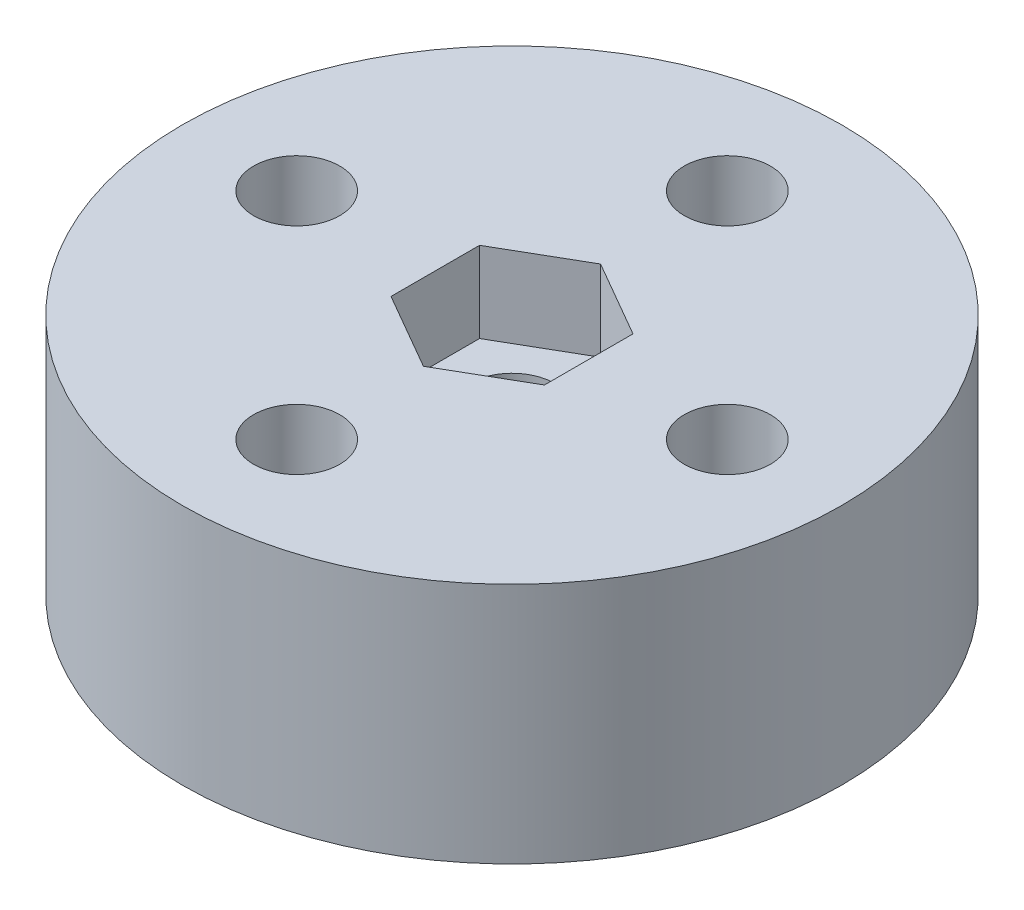
from build123d import *

# Parameters (mm, degrees)
SKETCH_1_R      = 12.25
SKETCH_1_R_2    = 1.6
EXTRUDE_1_DEPTH = 3
EXTRUDE_START   = 3
SKETCH_1_3_R    = 12.25
SKETCH_1_3_R_2  = 1.6
EXTRUDE_2_DEPTH = 3
SKETCH_1_4_R    = 1.6
EXTRUDE_3_DEPTH = 3
SKETCH_1_5_R    = 12.25
SKETCH_1_5_R_2  = 1.6
EXTRUDE_4_DEPTH = 3


with BuildPart() as part:
    # 草图1 → 凸台-拉伸1 (new body)
    # profile 1 of 2: a face of its own
    with BuildSketch(Plane(origin=(0, 0, 0), x_dir=(1, 0, 0), z_dir=(0, 1, 0))):
        with Locations(Location((0, 0, 0), (0, 0, 270))):
            Circle(SKETCH_1_R)
        with Locations(Location((-8, 0, 0), (0, 0, 270))):
            Circle(SKETCH_1_R_2, mode=Mode.SUBTRACT)
        with Locations(Location((0, -8, 0), (0, 0, 270))):
            Circle(SKETCH_1_R_2, mode=Mode.SUBTRACT)
        with Locations(Location((8, 0, 0), (0, 0, 270))):
            Circle(SKETCH_1_R_2, mode=Mode.SUBTRACT)
        with Locations(Location((0, 8, 0), (0, 0, 270))):
            Circle(SKETCH_1_R_2, mode=Mode.SUBTRACT)
        Polygon((-2.85, -1.645448267), (0, -3.290896534), (2.85, -1.645448267), (2.85, 1.645448267), (0, 3.290896534), (-2.85, 1.645448267), align=None, mode=Mode.SUBTRACT)
    # profile 2 of 2: a face of its own
    with BuildSketch(Plane(origin=(0, 0, 0), x_dir=(1, 0, 0), z_dir=(0, 1, 0))):
        Polygon((-2.85, 1.645448267), (-2.85, -1.645448267), (0, -3.290896534), (2.85, -1.645448267), (2.85, 1.645448267), (0, 3.290896534), align=None)
        with Locations(Location((0, 0, 0), (0, 0, 270))):
            Circle(SKETCH_1_R_2, mode=Mode.SUBTRACT)
    extrude(amount=-EXTRUDE_1_DEPTH)

    # 草图1<3> → 凸台-拉伸2 (add)
    with BuildSketch(Plane(origin=(0, 0, 0), x_dir=(1, 0, 0), z_dir=(0, 1, 0)).offset(EXTRUDE_START)):
        with Locations(Location((0, 0, 0), (0, 0, 270))):
            Circle(SKETCH_1_3_R)
        with Locations(Location((-8, 0, 0), (0, 0, 270))):
            Circle(SKETCH_1_3_R_2, mode=Mode.SUBTRACT)
        with Locations(Location((0, -8, 0), (0, 0, 270))):
            Circle(SKETCH_1_3_R_2, mode=Mode.SUBTRACT)
        with Locations(Location((8, 0, 0), (0, 0, 270))):
            Circle(SKETCH_1_3_R_2, mode=Mode.SUBTRACT)
        with Locations(Location((0, 8, 0), (0, 0, 270))):
            Circle(SKETCH_1_3_R_2, mode=Mode.SUBTRACT)
        Polygon((-2.85, -1.645448267), (0, -3.290896534), (2.85, -1.645448267), (2.85, 1.645448267), (0, 3.290896534), (-2.85, 1.645448267), align=None, mode=Mode.SUBTRACT)
    extrude(amount=-EXTRUDE_2_DEPTH)

    # 草图1<4> → 凸台-拉伸3 (add)
    with BuildSketch(Plane(origin=(0, 0, 0), x_dir=(1, 0, 0), z_dir=(0, 1, 0)).offset(EXTRUDE_START)):
        Polygon((-2.85, 1.645448267), (-2.85, -1.645448267), (0, -3.290896534), (2.85, -1.645448267), (2.85, 1.645448267), (0, 3.290896534), align=None)
        with Locations(Location((0, 0, 0), (0, 0, 270))):
            Circle(SKETCH_1_4_R, mode=Mode.SUBTRACT)
    extrude(amount=-EXTRUDE_3_DEPTH)

    # 草图1<5> → 凸台-拉伸4 (add)
    with BuildSketch(Plane(origin=(0, 0, 0), x_dir=(1, 0, 0), z_dir=(0, 1, 0)).offset(EXTRUDE_START)):
        with Locations(Location((0, 0, 0), (0, 0, 270))):
            Circle(SKETCH_1_5_R)
        with Locations(Location((-8, 0, 0), (0, 0, 270))):
            Circle(SKETCH_1_5_R_2, mode=Mode.SUBTRACT)
        with Locations(Location((0, -8, 0), (0, 0, 270))):
            Circle(SKETCH_1_5_R_2, mode=Mode.SUBTRACT)
        with Locations(Location((8, 0, 0), (0, 0, 270))):
            Circle(SKETCH_1_5_R_2, mode=Mode.SUBTRACT)
        with Locations(Location((0, 8, 0), (0, 0, 270))):
            Circle(SKETCH_1_5_R_2, mode=Mode.SUBTRACT)
        Polygon((-2.85, -1.645448267), (0, -3.290896534), (2.85, -1.645448267), (2.85, 1.645448267), (0, 3.290896534), (-2.85, 1.645448267), align=None, mode=Mode.SUBTRACT)
    extrude(amount=EXTRUDE_4_DEPTH)


solid = part.part
